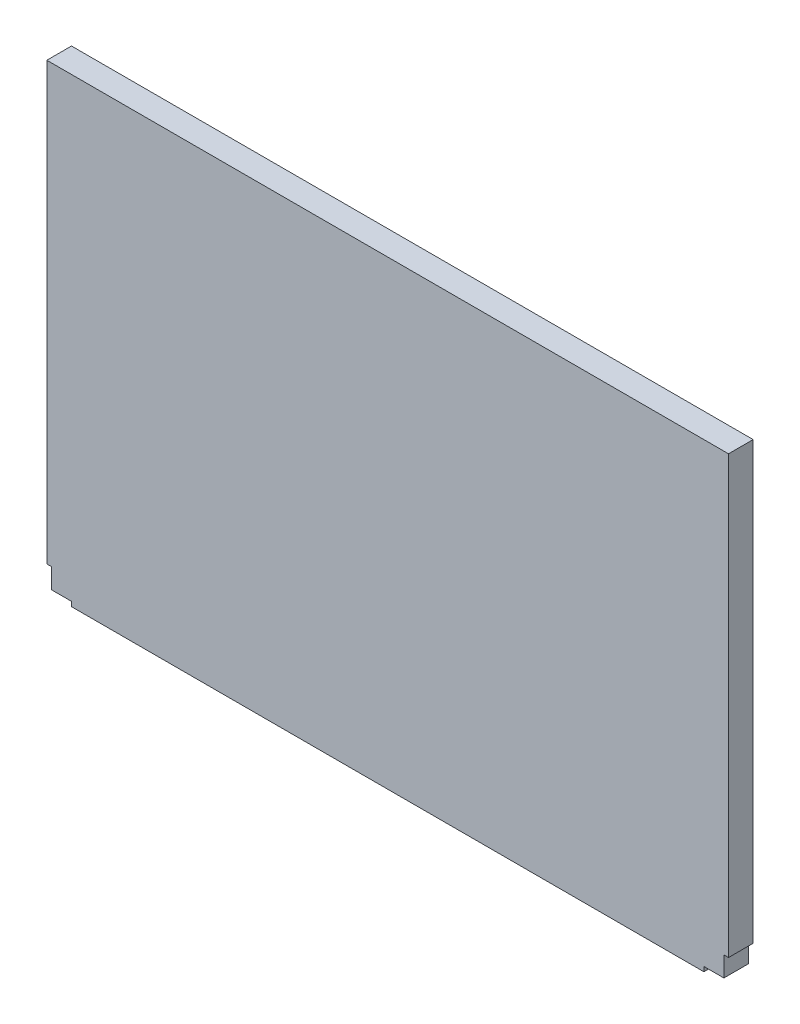
from build123d import *

# Parameters (mm, degrees)
CROQUIS1_W              = 1405
CROQUIS1_H              = 950
SALIENTE_EXTRUIR1_DEPTH = 50.8
CORTAR_EXTRUIR1_DEPTH   = 51


with BuildPart() as part:
    # Croquis1 → Saliente-Extruir1 (new body)
    with BuildSketch(Plane.XY):
        with Locations((702.5, -475)):
            Rectangle(CROQUIS1_W, CROQUIS1_H)
    extrude(amount=SALIENTE_EXTRUIR1_DEPTH)

    # Croquis2 → Cortar-Extruir1 (cut)
    with BuildSketch(Plane.XY.offset(50.8)):
        Polygon((0, -899.2), (9.525, -899.2), (9.525, -940.475), (50.8, -940.475), (50.8, -950), (0, -950), align=None)
        Polygon((1405, -950), (1405, -899.2), (1395.475, -899.2), (1395.475, -940.475), (1354.2, -940.475), (1354.2, -950), align=None)
    extrude(amount=-CORTAR_EXTRUIR1_DEPTH, mode=Mode.SUBTRACT)


solid = part.part
